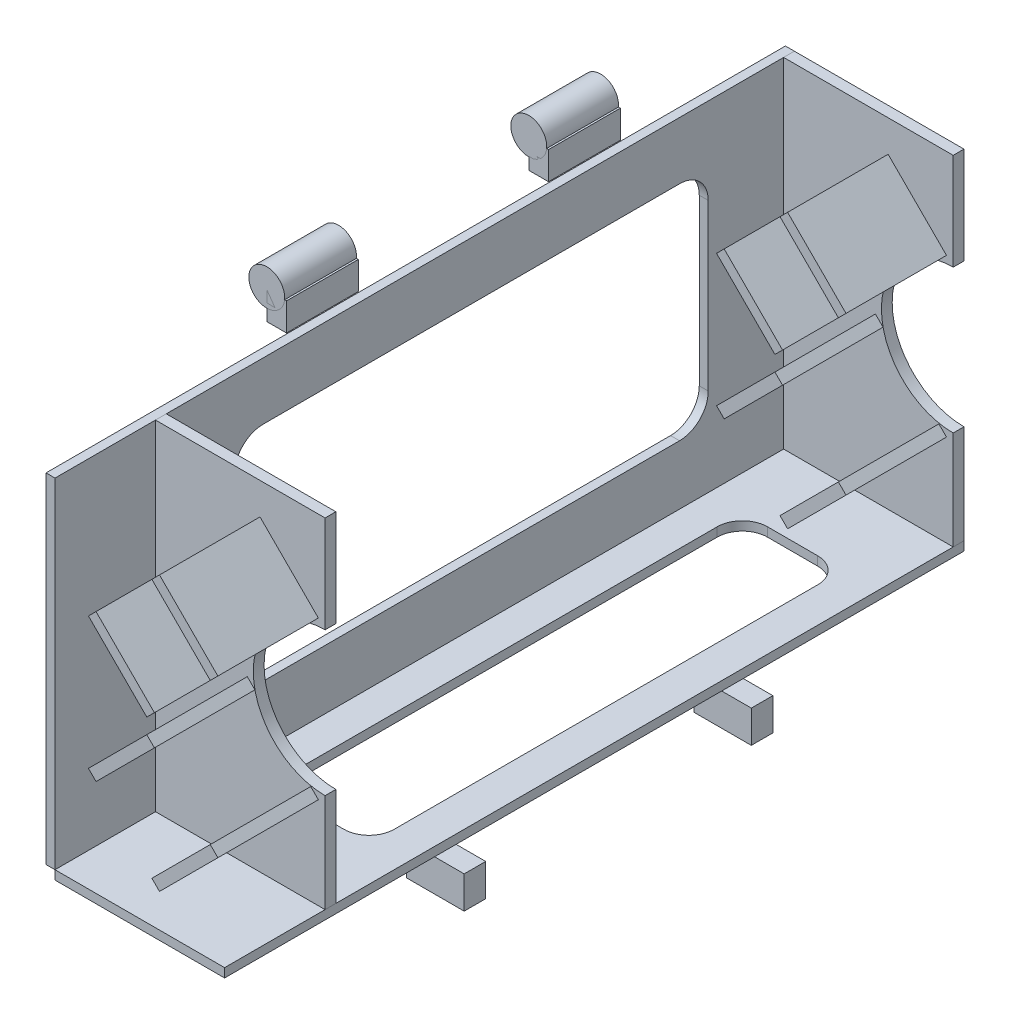
from build123d import *

# Parameters (mm, degrees)
EXTRUDE_START       = 180
EXTRUDE_1_DEPTH     = 6
EXTRUDE_START_2     = 186
EXTRUDE_2_DEPTH     = 56
EXTRUDE_3_DEPTH     = 56
EXTRUDE_4_DEPTH     = 56
EXTRUDE_5_DEPTH     = 56
EXTRUDE_START_3     = 530
EXTRUDE_6_DEPTH     = 6
EXTRUDE_START_4     = 536
EXTRUDE_7_DEPTH     = 56
EXTRUDE_8_DEPTH     = 56
EXTRUDE_9_DEPTH     = 56
EXTRUDE_10_DEPTH    = 56
EXTRUDE_START_5     = -100
EXTRUDE_SKETCH_11_W = 412
EXTRUDE_SKETCH_11_H = 189
EXTRUDE_11_DEPTH    = 5
EXTRUDE_SKETCH_12_W = 94.5
EXTRUDE_SKETCH_12_H = 412
EXTRUDE_12_DEPTH    = 5
EXTRUDE_START_6     = 272
EXTRUDE_SKETCH_13_R = 10
EXTRUDE_13_DEPTH    = 40
EXTRUDE_SKETCH_14_W = 11
EXTRUDE_SKETCH_14_H = 15.5
EXTRUDE_14_DEPTH    = 40
EXTRUDE_START_7     = 418
EXTRUDE_SKETCH_15_R = 10
EXTRUDE_15_DEPTH    = 40
EXTRUDE_SKETCH_16_W = 11
EXTRUDE_SKETCH_16_H = 15.5
EXTRUDE_16_DEPTH    = 40
EXTRUDE_START_8     = 303
EXTRUDE_SKETCH_17_W = 32
EXTRUDE_SKETCH_17_H = 18
EXTRUDE_17_DEPTH    = 12
EXTRUDE_START_9     = 463
EXTRUDE_SKETCH_18_W = 32
EXTRUDE_SKETCH_18_H = 18
EXTRUDE_18_DEPTH    = 12


with BuildPart() as part:
    # Extrude sketch 1 → Extrude 1 (new body)
    with BuildSketch(Plane.XY.offset(EXTRUDE_START)):
        with BuildLine():
            Line((-95, 94), (-95, -95))
            Line((-95, -95), (-0.5, -95))
            Line((-0.5, -95), (-0.5, -40))
            ThreePointArc((-0.5, -40), (-40.5, 0), (-0.5, 40))
            Line((-0.5, 40), (-0.5, 94))
            Line((-0.5, 94), (-95, 94))
        make_face()
    extrude(amount=EXTRUDE_1_DEPTH)


with BuildPart() as body_2:
    # Extrude sketch 2 → Extrude 2 (new body)
    with BuildSketch(Plane.XY.offset(EXTRUDE_START_2)):
        Polygon((-39.597979746, 8.485281374), (-72.124891681, 41.012193309), (-76.367532368, 36.769552622), (-43.840620434, 4.242640687), align=None)
    extrude(amount=EXTRUDE_2_DEPTH)


with BuildPart() as body_3:
    # Extrude sketch 3 → Extrude 3 (new body)
    with BuildSketch(Plane.XY.offset(EXTRUDE_START_2)):
        Polygon((-41.012193309, 72.124891681), (-8.485281374, 39.597979746), (-4.242640687, 43.840620434), (-36.769552622, 76.367532368), align=None)
    extrude(amount=EXTRUDE_3_DEPTH)


with BuildPart() as body_4:
    # Extrude sketch 4 → Extrude 4 (new body)
    with BuildSketch(Plane.XY.offset(EXTRUDE_START_2)):
        Polygon((-8.485281374, -39.597979746), (-41.012193309, -72.124891681), (-36.769552622, -76.367532368), (-4.242640687, -43.840620434), align=None)
    extrude(amount=EXTRUDE_4_DEPTH)


with BuildPart() as body_5:
    # Extrude sketch 5 → Extrude 5 (new body)
    with BuildSketch(Plane.XY.offset(EXTRUDE_START_2)):
        Polygon((-43.840620434, -4.242640687), (-76.367532368, -36.769552622), (-72.124891681, -41.012193309), (-39.597979746, -8.485281374), align=None)
    extrude(amount=EXTRUDE_5_DEPTH)


with BuildPart() as body_6:
    # Extrude sketch 6 → Extrude 6 (new body)
    with BuildSketch(Plane.XY.offset(EXTRUDE_START_3)):
        with BuildLine():
            Line((-95, 94), (-95, -95))
            Line((-95, -95), (-0.5, -95))
            Line((-0.5, -95), (-0.5, -40))
            ThreePointArc((-0.5, -40), (-40.5, 0), (-0.5, 40))
            Line((-0.5, 40), (-0.5, 94))
            Line((-0.5, 94), (-95, 94))
        make_face()
    extrude(amount=EXTRUDE_6_DEPTH)


with BuildPart() as body_7:
    # Extrude sketch 7 → Extrude 7 (new body)
    with BuildSketch(Plane.XY.offset(EXTRUDE_START_4)):
        Polygon((-39.597979746, 8.485281374), (-72.124891681, 41.012193309), (-76.367532368, 36.769552622), (-43.840620434, 4.242640687), align=None)
    extrude(amount=EXTRUDE_7_DEPTH)


with BuildPart() as body_8:
    # Extrude sketch 8 → Extrude 8 (new body)
    with BuildSketch(Plane.XY.offset(EXTRUDE_START_4)):
        Polygon((-41.012193309, 72.124891681), (-8.485281374, 39.597979746), (-4.242640687, 43.840620434), (-36.769552622, 76.367532368), align=None)
    extrude(amount=EXTRUDE_8_DEPTH)


with BuildPart() as body_9:
    # Extrude sketch 9 → Extrude 9 (new body)
    with BuildSketch(Plane.XY.offset(EXTRUDE_START_4)):
        Polygon((-8.485281374, -39.597979746), (-41.012193309, -72.124891681), (-36.769552622, -76.367532368), (-4.242640687, -43.840620434), align=None)
    extrude(amount=EXTRUDE_9_DEPTH)


with BuildPart() as body_10:
    # Extrude sketch 10 → Extrude 10 (new body)
    with BuildSketch(Plane.XY.offset(EXTRUDE_START_4)):
        Polygon((-43.840620434, -4.242640687), (-76.367532368, -36.769552622), (-72.124891681, -41.012193309), (-39.597979746, -8.485281374), align=None)
    extrude(amount=EXTRUDE_10_DEPTH)


with BuildPart() as body_11:
    # Extrude sketch 11 → Extrude 11 (new body)
    with BuildSketch(Plane(origin=(0, 0, 0), x_dir=(0, 0, -1), z_dir=(1, 0, 0)).offset(EXTRUDE_START_5)):
        with Locations((-386, -0.5)):
            Rectangle(EXTRUDE_SKETCH_11_W, EXTRUDE_SKETCH_11_H)
        with BuildLine():
            Line((-244, 62), (-476, 62))
            ThreePointArc((-476, 62), (-487.313708499, 57.313708499), (-492, 46))
            Line((-492, 46), (-492, -46))
            ThreePointArc((-492, -46), (-487.313708499, -57.313708499), (-476, -62))
            Line((-476, -62), (-244, -62))
            ThreePointArc((-244, -62), (-232.686291501, -57.313708499), (-228, -46))
            Line((-228, -46), (-228, 46))
            ThreePointArc((-228, 46), (-232.686291501, 57.313708499), (-244, 62))
        make_face(mode=Mode.SUBTRACT)
    extrude(amount=EXTRUDE_11_DEPTH)


with BuildPart() as body_12:
    # Extrude sketch 12 → Extrude 12 (new body)
    with BuildSketch(Plane(origin=(0, 0, 0), x_dir=(1, 0, 0), z_dir=(0, 1, 0)).offset(EXTRUDE_START_5)):
        with Locations((-47.75, -386)):
            Rectangle(EXTRUDE_SKETCH_12_W, EXTRUDE_SKETCH_12_H)
        with BuildLine():
            Line((-20, -242), (-20, -478))
            ThreePointArc((-20, -478), (-24.100505063, -487.899494937), (-34, -492))
            Line((-34, -492), (-62, -492))
            ThreePointArc((-62, -492), (-71.899494937, -487.899494937), (-76, -478))
            Line((-76, -478), (-76, -242))
            ThreePointArc((-76, -242), (-71.899494937, -232.100505063), (-62, -228))
            Line((-62, -228), (-34, -228))
            ThreePointArc((-34, -228), (-24.100505063, -232.100505063), (-20, -242))
        make_face(mode=Mode.SUBTRACT)
    extrude(amount=EXTRUDE_12_DEPTH)


with BuildPart() as body_13:
    # Extrude sketch 13 → Extrude 13 (new body)
    with BuildSketch(Plane.XY.offset(EXTRUDE_START_6)):
        with Locations((-111, 111)):
            Circle(EXTRUDE_SKETCH_13_R)
    extrude(amount=EXTRUDE_13_DEPTH)


with BuildPart() as body_14:
    # Extrude sketch 14 → Extrude 14 (new body)
    with BuildSketch(Plane.XY.offset(EXTRUDE_START_6)):
        with Locations((-105.5, 102.25)):
            Rectangle(EXTRUDE_SKETCH_14_W, EXTRUDE_SKETCH_14_H)
    extrude(amount=EXTRUDE_14_DEPTH)


with BuildPart() as body_15:
    # Extrude sketch 15 → Extrude 15 (new body)
    with BuildSketch(Plane.XY.offset(EXTRUDE_START_7)):
        with Locations((-111, 111)):
            Circle(EXTRUDE_SKETCH_15_R)
    extrude(amount=EXTRUDE_15_DEPTH)


with BuildPart() as body_16:
    # Extrude sketch 16 → Extrude 16 (new body)
    with BuildSketch(Plane.XY.offset(EXTRUDE_START_7)):
        with Locations((-105.5, 102.25)):
            Rectangle(EXTRUDE_SKETCH_16_W, EXTRUDE_SKETCH_16_H)
    extrude(amount=EXTRUDE_16_DEPTH)


with BuildPart() as body_17:
    # Extrude sketch 17 → Extrude 17 (new body)
    with BuildSketch(Plane.XY.offset(EXTRUDE_START_8)):
        with Locations((0, -109)):
            Rectangle(EXTRUDE_SKETCH_17_W, EXTRUDE_SKETCH_17_H)
    extrude(amount=EXTRUDE_17_DEPTH)


with BuildPart() as body_18:
    # Extrude sketch 18 → Extrude 18 (new body)
    with BuildSketch(Plane.XY.offset(EXTRUDE_START_9)):
        with Locations((0, -109)):
            Rectangle(EXTRUDE_SKETCH_18_W, EXTRUDE_SKETCH_18_H)
    extrude(amount=EXTRUDE_18_DEPTH)


solid = Compound([part.part, body_2.part, body_3.part, body_4.part, body_5.part, body_6.part, body_7.part, body_8.part, body_9.part, body_10.part, body_11.part, body_12.part, body_13.part, body_14.part, body_15.part, body_16.part, body_17.part, body_18.part])
